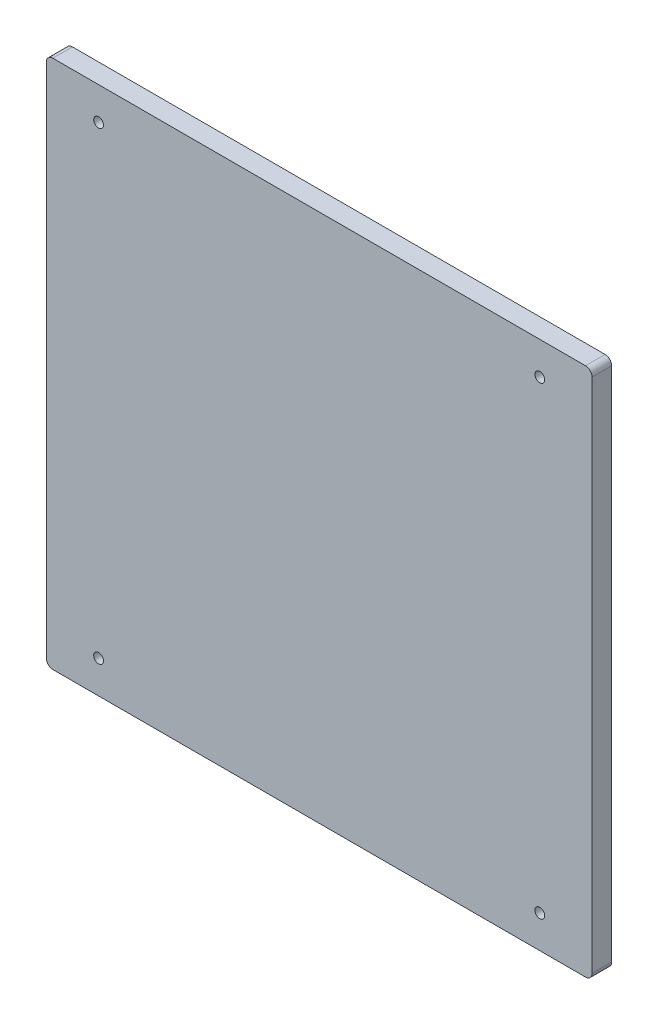
from build123d import *

# Parameters (mm, degrees)
ESBO_O1_R                = 1.5
RESSALTO_EXTRUS_O1_DEPTH = 6


with BuildPart() as part:
    # Esboço1 → Ressalto-extrusão1 (new body)
    with BuildSketch(Plane.XY):
        with BuildLine():
            Line((81.5, -81), (-81.5, -81))
            ThreePointArc((-81.5, -81), (-82.914213562, -80.414213562), (-83.5, -79))
            Line((-83.5, -79), (-83.5, 79))
            ThreePointArc((-83.5, 79), (-82.914213562, 80.414213562), (-81.5, 81))
            Line((-81.5, 81), (81.5, 81))
            ThreePointArc((81.5, 81), (82.914213562, 80.414213562), (83.5, 79))
            Line((83.5, 79), (83.5, -79))
            ThreePointArc((83.5, -79), (82.914213562, -80.414213562), (81.5, -81))
        make_face()
        with Locations((-67.5, 71)):
            Circle(ESBO_O1_R, mode=Mode.SUBTRACT)
        with Locations((67.5, 71)):
            Circle(ESBO_O1_R, mode=Mode.SUBTRACT)
        with Locations((67.5, -71)):
            Circle(ESBO_O1_R, mode=Mode.SUBTRACT)
        with Locations((-67.5, -71)):
            Circle(ESBO_O1_R, mode=Mode.SUBTRACT)
    extrude(amount=RESSALTO_EXTRUS_O1_DEPTH)


solid = part.part
